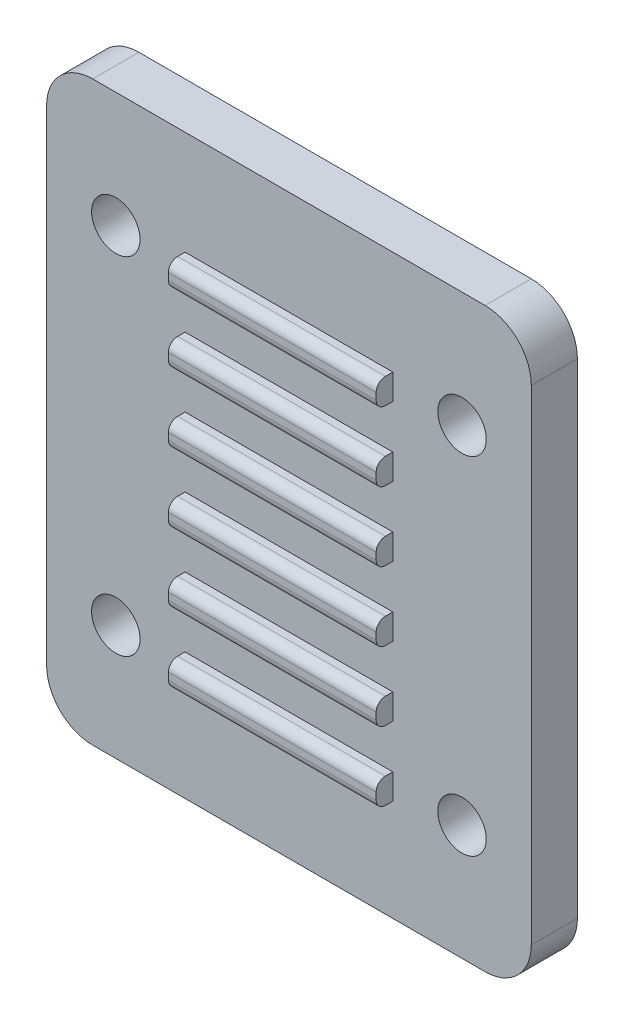
from build123d import *

# Parameters (mm, degrees)
SKETCH_1_W      = 21
SKETCH_1_H      = 25
SKETCH_1_R      = 1.05
EXTRUDE_1_DEPTH = 2
SKETCH_2_W      = 9
SKETCH_2_H      = 1.1
EXTRUDE_2_DEPTH = 0.72
FILLET_1_R      = 2
FILLET_3_R      = 0.4


with BuildPart() as part:
    # 草图1 → 凸台-拉伸1 (new body)
    with BuildSketch(Plane.XY):
        with Locations((10.5, -12.5)):
            Rectangle(SKETCH_1_W, SKETCH_1_H)
        with Locations((3, -5)):
            Circle(SKETCH_1_R, mode=Mode.SUBTRACT)
        with Locations((18, -5)):
            Circle(SKETCH_1_R, mode=Mode.SUBTRACT)
        with Locations((3, -20)):
            Circle(SKETCH_1_R, mode=Mode.SUBTRACT)
        with Locations((18, -20)):
            Circle(SKETCH_1_R, mode=Mode.SUBTRACT)
    extrude(amount=EXTRUDE_1_DEPTH)

    # 草图2 → 凸台-拉伸2 (add)
    with BuildSketch(Plane.XY.offset(2)):
        with Locations((10.5, -5.05)):
            Rectangle(SKETCH_2_W, SKETCH_2_H)
        with Locations((10.5, -8.05)):
            Rectangle(SKETCH_2_W, SKETCH_2_H)
        with Locations((10.5, -11.05)):
            Rectangle(SKETCH_2_W, SKETCH_2_H)
        with Locations((10.5, -14.05)):
            Rectangle(SKETCH_2_W, SKETCH_2_H)
        with Locations((10.5, -17.05)):
            Rectangle(SKETCH_2_W, SKETCH_2_H)
        with Locations((10.5, -20.05)):
            Rectangle(SKETCH_2_W, SKETCH_2_H)
    extrude(amount=EXTRUDE_2_DEPTH)

    # 圆角1
    fillet_1_edges = [part.edges().sort_by_distance(p)[0] for p in [
        (0, 0, 1),
        (21, 0, 1),
        (21, -25, 1),
        (0, -25, 1),
    ]]
    fillet(fillet_1_edges, radius=FILLET_1_R)

    # 圆角3
    fillet_3_edges = [part.edges().sort_by_distance(p)[0] for p in [
        (10.5, -5.6, 2.72),
        (10.5, -4.5, 2.72),
        (10.5, -7.5, 2.72),
        (10.5, -8.6, 2.72),
        (10.5, -10.5, 2.72),
        (10.5, -11.6, 2.72),
        (10.5, -13.5, 2.72),
        (10.5, -14.6, 2.72),
        (10.5, -16.5, 2.72),
        (10.5, -17.6, 2.72),
        (10.5, -19.5, 2.72),
        (10.5, -20.6, 2.72),
    ]]
    fillet(fillet_3_edges, radius=FILLET_3_R)


solid = part.part
